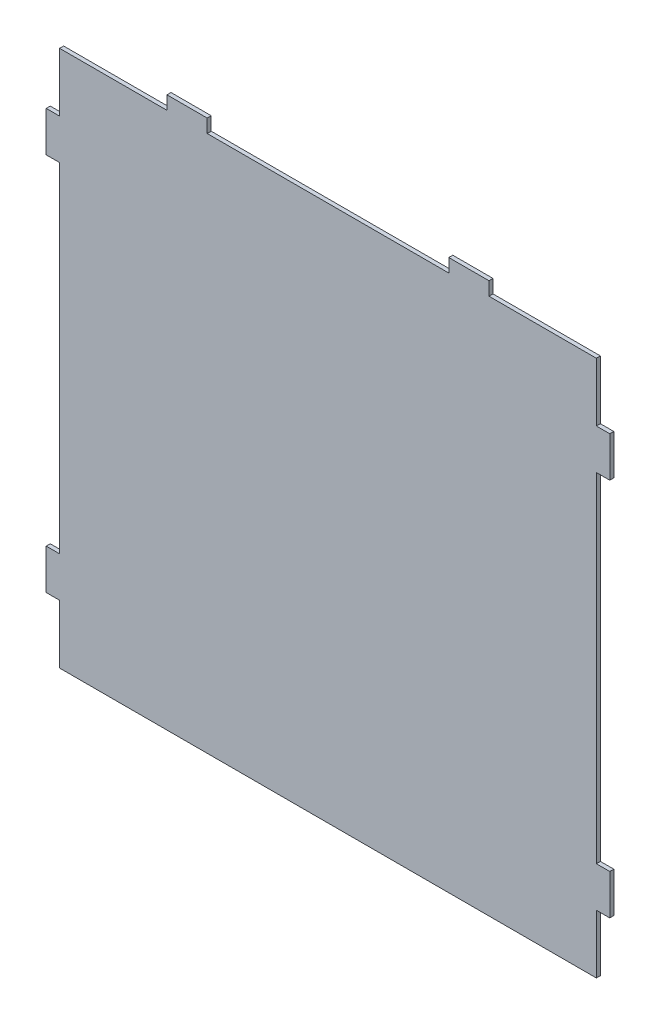
from build123d import *

# Parameters (mm, degrees)
CROQUIS1_W              = 400
CROQUIS1_H              = 400
CROQUIS1_W_2            = 10
CROQUIS1_H_2            = 30
CROQUIS1_W_3            = 30
CROQUIS1_H_3            = 10
SALIENTE_EXTRUIR1_DEPTH = 3


with BuildPart() as part:
    # Croquis1 → Saliente-Extruir1 (new body)
    with BuildSketch(Plane.XY):
        Rectangle(CROQUIS1_W, CROQUIS1_H)
        with Locations((205, 141.243683163)):
            Rectangle(CROQUIS1_W_2, CROQUIS1_H_2)
        with Locations((205, -141.243683163)):
            Rectangle(CROQUIS1_W_2, CROQUIS1_H_2)
        with Locations((-205, -141.243683163)):
            Rectangle(CROQUIS1_W_2, CROQUIS1_H_2)
        with Locations((-205, 141.243683163)):
            Rectangle(CROQUIS1_W_2, CROQUIS1_H_2)
        with Locations((-105, 205)):
            Rectangle(CROQUIS1_W_3, CROQUIS1_H_3)
        with Locations((105, 205)):
            Rectangle(CROQUIS1_W_3, CROQUIS1_H_3)
    extrude(amount=SALIENTE_EXTRUIR1_DEPTH)


solid = part.part
